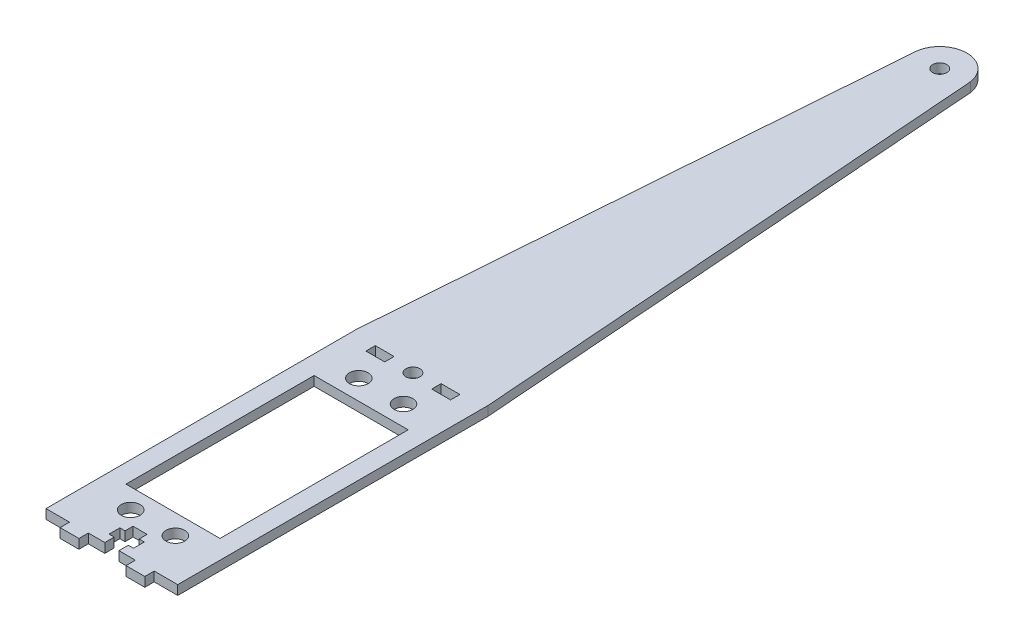
from build123d import *

# Parameters (mm, degrees)
SKETCH1_R           = 2
SKETCH1_R_2         = 1.5
SKETCH1_W           = 20
SKETCH1_H           = 40
SKETCH1_W_2         = 4
SKETCH1_H_2         = 2
BOSS_EXTRUDE1_DEPTH = 2
BOSS_EXTRUDE2_DEPTH = 2
SKETCH4_R           = 1.5
CUT_EXTRUDE1_DEPTH  = 2


with BuildPart() as part:
    # Sketch1 → Boss-Extrude1 (new body)
    with BuildSketch(Plane(origin=(0, 0, 0), x_dir=(1, 0, 0), z_dir=(0, 1, 0))):
        Polygon((0, 0), (5, 0), (5, -2), (9, -2), (9, 0), (12.5, 0), (12.5, 2), (11.4, 2), (11.4, 4.3), (12.5, 4.3), (12.5, 6), (15.5, 6), (15.5, 4.3), (16.6, 4.3), (16.6, 2), (15.5, 2), (15.5, 0), (19, 0), (19, -2), (23, -2), (23, 0), (28, 0), (28, 66), (0, 66), align=None)
        with Locations(Location((18.75, 57.25, 0), (0, 0, 270))):
            Circle(SKETCH1_R, mode=Mode.SUBTRACT)
        with Locations(Location((9.25, 57.25, 0), (0, 0, 90))):
            Circle(SKETCH1_R, mode=Mode.SUBTRACT)
        with Locations(Location((18.75, 8.75, 0), (0, 0, 90))):
            Circle(SKETCH1_R, mode=Mode.SUBTRACT)
        with Locations(Location((9.25, 8.75, 0), (0, 0, 270))):
            Circle(SKETCH1_R, mode=Mode.SUBTRACT)
        with Locations(Location((14, 64, 0), (0, 0, 270))):
            Circle(SKETCH1_R_2, mode=Mode.SUBTRACT)
        with Locations((14, 33)):
            Rectangle(SKETCH1_W, SKETCH1_H, mode=Mode.SUBTRACT)
        with Locations((7, 64)):
            Rectangle(SKETCH1_W_2, SKETCH1_H_2, mode=Mode.SUBTRACT)
        with Locations((21, 64)):
            Rectangle(SKETCH1_W_2, SKETCH1_H_2, mode=Mode.SUBTRACT)
    extrude(amount=BOSS_EXTRUDE1_DEPTH)

    # Sketch2 → Boss-Extrude2 (add)
    with BuildSketch(Plane(origin=(0, 2, 0), x_dir=(1, 0, 0), z_dir=(0, 1, 0))):
        with BuildLine():
            Line((9, 186), (0, 66))
            Line((0, 66), (28, 66))
            Line((28, 66), (19, 186))
            ThreePointArc((19, 186), (14, 191), (9, 186))
        make_face()
    extrude(amount=-BOSS_EXTRUDE2_DEPTH)

    # Sketch4 → Cut-Extrude1 (cut)
    with BuildSketch(Plane(origin=(0, 2, 0), x_dir=(1, 0, 0), z_dir=(0, 1, 0))):
        with Locations(Location((14, 176, 0), (0, 0, 270))):
            Circle(SKETCH4_R)
        with BuildLine():
            Line((1.336247038, 176), (8.25, 176))
            ThreePointArc((8.25, 176), (14, 181.75), (19.75, 176))
            Line((19.75, 176), (26.690607085, 176))
            Line((26.690607085, 176), (26.690607085, 198.806068599))
            Line((26.690607085, 198.806068599), (1.336247038, 198.806068599))
            Line((1.336247038, 198.806068599), (1.336247038, 176))
        make_face()
    extrude(amount=-CUT_EXTRUDE1_DEPTH, mode=Mode.SUBTRACT)


solid = part.part
